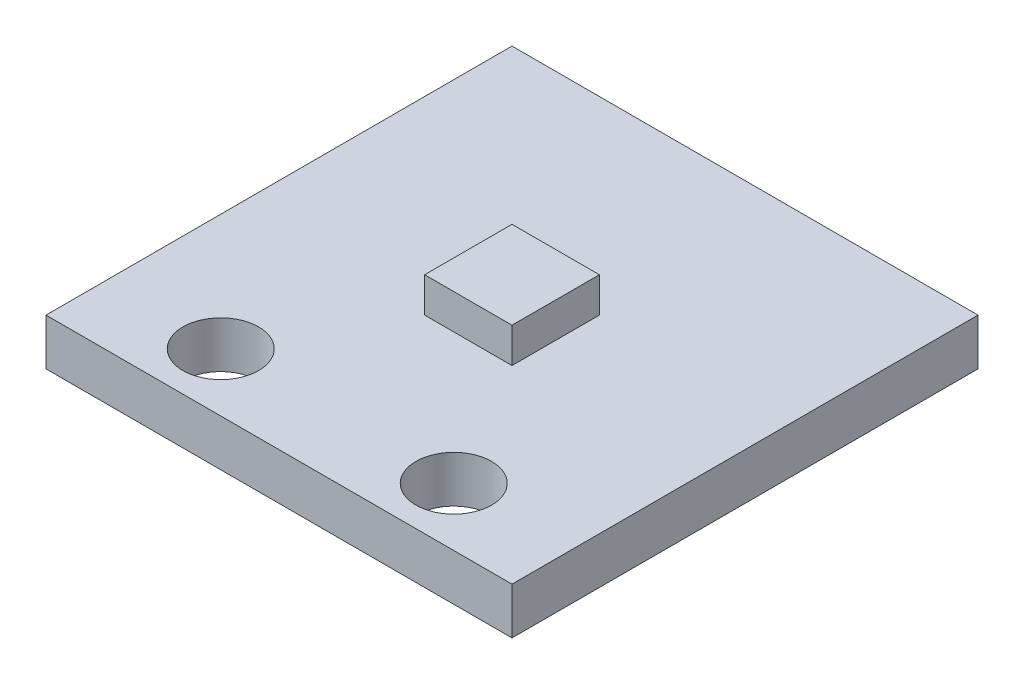
from build123d import *

# Parameters (mm, degrees)
V10_SHT_CANDIDATE_CARRIER16X16_START   = 54
SKETCH_2_W                             = 16
SKETCH_2_H                             = 1.6
V10_SHT_CANDIDATE_CARRIER16X16_DEPTH   = 16
V10_SHT_SENSING_PACKAGE_REARWARD_START = 60.5
SKETCH_3_W                             = 3
SKETCH_3_H                             = 1.2
V10_SHT_SENSING_PACKAGE_REARWARD_DEPTH = 3
SKETCH_4_R                             = 1.3
V10_SHT_TWO_CANDIDATE_HOLES8MM_DEPTH   = 1.6


with BuildPart() as part:
    # 草图2 → V10_SHT_candidate_carrier16x16 (new body)
    with BuildSketch(Plane.XY.offset(V10_SHT_CANDIDATE_CARRIER16X16_START)):
        with Locations((-122, 133.2)):
            Rectangle(SKETCH_2_W, SKETCH_2_H)
    extrude(amount=V10_SHT_CANDIDATE_CARRIER16X16_DEPTH)

    # 草图3 → V10_SHT_sensing_package_rearward (add)
    with BuildSketch(Plane.XY.offset(V10_SHT_SENSING_PACKAGE_REARWARD_START)):
        with Locations((-122, 134.6)):
            Rectangle(SKETCH_3_W, SKETCH_3_H)
    extrude(amount=V10_SHT_SENSING_PACKAGE_REARWARD_DEPTH)

    # 草图4 → V10_SHT_two_candidate_holes8mm (cut)
    with BuildSketch(Plane.XZ.offset(-132.4)):
        with Locations((-126, 68)):
            Circle(SKETCH_4_R)
        with Locations((-118, 68)):
            Circle(SKETCH_4_R)
    extrude(amount=-V10_SHT_TWO_CANDIDATE_HOLES8MM_DEPTH, mode=Mode.SUBTRACT)


solid = part.part
